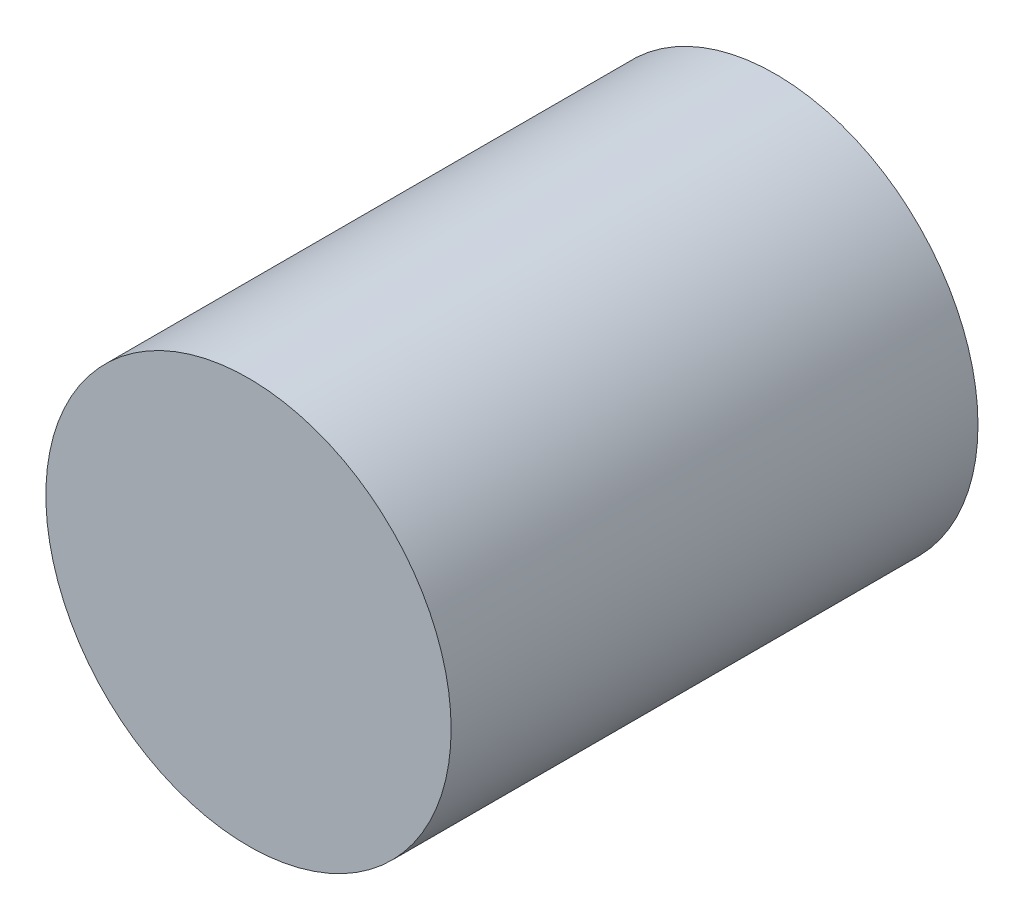
from build123d import *

# Parameters (mm, degrees)
SKETCH_1_R      = 25
EXTRUDE_1_DEPTH = 65


with BuildPart() as part:
    # 草图1 → 凸台-拉伸1 (new body)
    with BuildSketch(Plane.XY):
        Circle(SKETCH_1_R)
    extrude(amount=EXTRUDE_1_DEPTH)


solid = part.part
